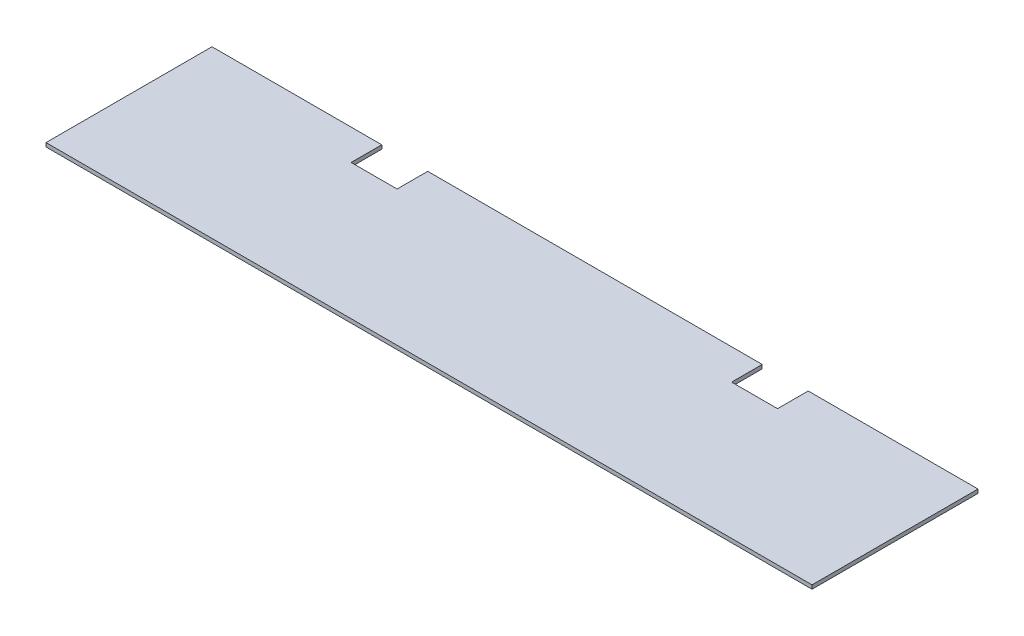
from build123d import *

# Parameters (mm, degrees)
RESSALTO_EXTRUS_O1_DEPTH = 1.5


with BuildPart() as part:
    # Esboço1 → Ressalto-extrusão1 (new body)
    with BuildSketch(Plane(origin=(0, 0, 0), x_dir=(1, 0, 0), z_dir=(0, 1, 0))):
        Polygon((0, 0), (300, 0), (300, 65), (233.5, 65), (233.5, 53), (215.5, 53), (215.5, 65), (84.5, 65), (84.5, 53), (66.5, 53), (66.5, 65), (0, 65), align=None)
    extrude(amount=RESSALTO_EXTRUS_O1_DEPTH)


solid = part.part
